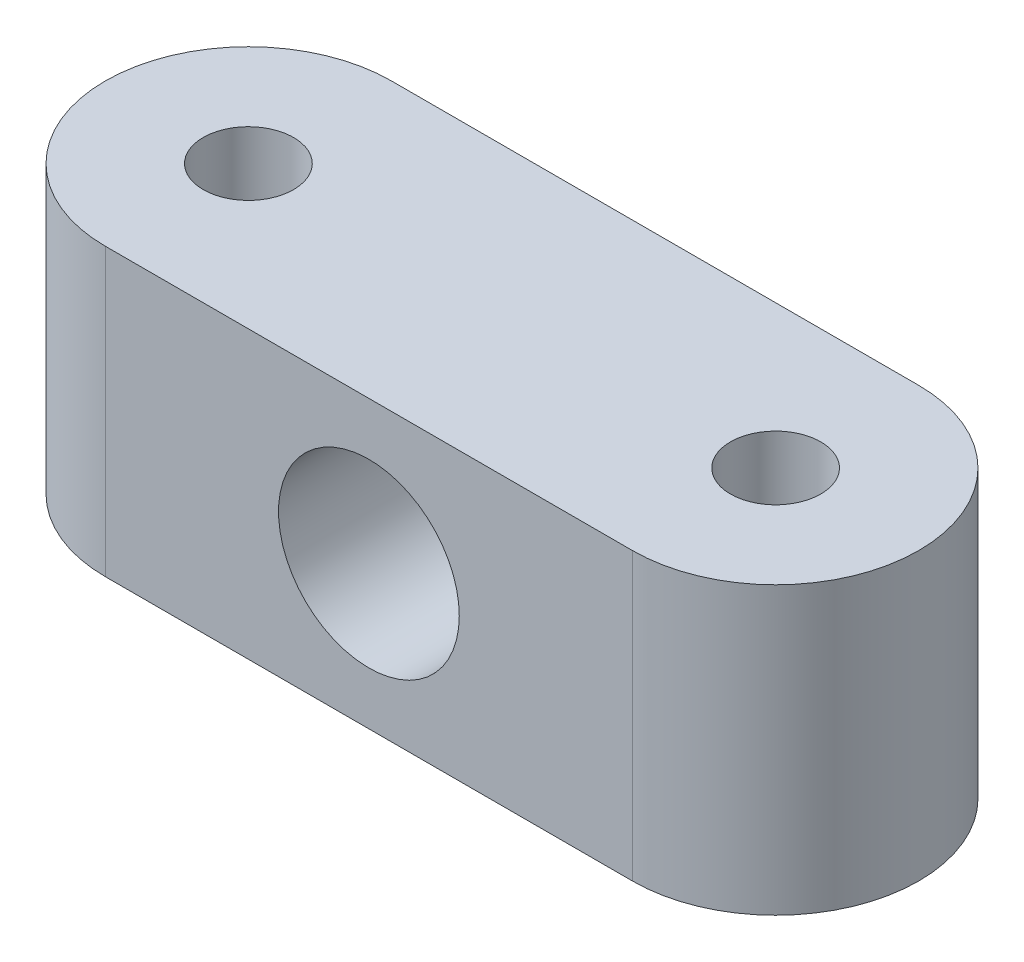
from build123d import *

# Parameters (mm, degrees)
SKETCH1_R           = 6
BOSS_EXTRUDE1_DEPTH = 38
SKETCH2_R           = 12
CUT_EXTRUDE1_DEPTH  = 104.966340707


with BuildPart() as part:
    # Sketch1 → Boss-Extrude1 (new body)
    with BuildSketch(Plane(origin=(0, 0, 0), x_dir=(1, 0, 0), z_dir=(0, 1, 0))):
        with BuildLine():
            Line((0, 19), (70, 19))
            ThreePointArc((70, 19), (89, 0), (70, -19))
            Line((70, -19), (0, -19))
            ThreePointArc((0, -19), (-19, 0), (0, 19))
        make_face()
        with Locations(Location((0, 0, 0), (0, 0, 270))):
            Circle(SKETCH1_R, mode=Mode.SUBTRACT)
        with Locations(Location((70, 0, 0), (0, 0, 270))):
            Circle(SKETCH1_R, mode=Mode.SUBTRACT)
    extrude(amount=BOSS_EXTRUDE1_DEPTH)

    # Sketch2 → Cut-Extrude1 (cut, through all)
    with BuildSketch(Plane.XY.offset(19)):
        with Locations((35, 19)):
            Circle(SKETCH2_R)
    extrude(amount=-CUT_EXTRUDE1_DEPTH, mode=Mode.SUBTRACT)


solid = part.part
